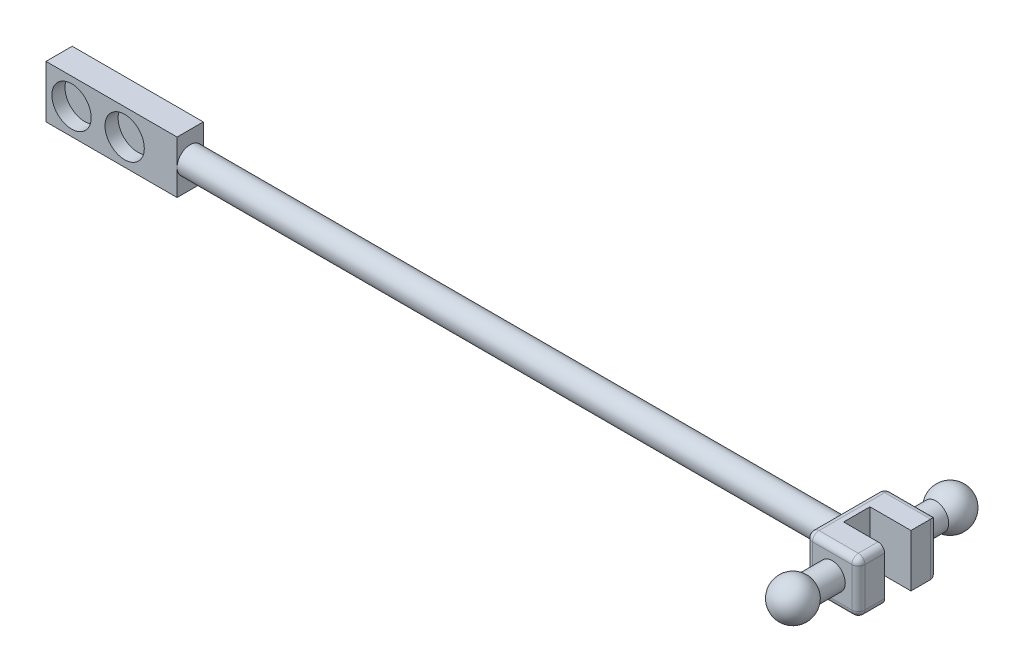
from build123d import *

# Parameters (mm, degrees)
SKETCH1_W           = 10
SKETCH1_H           = 4
BOSS_EXTRUDE1_DEPTH = 2
SKETCH2_R           = 1.5
CUT_EXTRUDE1_DEPTH  = 1
SKETCH3_R           = 1
BOSS_EXTRUDE2_DEPTH = 50
BOSS_EXTRUDE3_DEPTH = 4
FILLET1_R           = 0.5
SKETCH6_R           = 1
BOSS_EXTRUDE6_DEPTH = 3
FILLET2_R           = 0.5
SKETCH18_R          = 0.996476916
BOSS_EXTRUDE7_DEPTH = 3


with BuildPart() as part:
    # Sketch1 → Boss-Extrude1 (new body)
    with BuildSketch(Plane.XY):
        with Locations((-90.227807008, -9.049640054)):
            Rectangle(SKETCH1_W, SKETCH1_H)
    extrude(amount=BOSS_EXTRUDE1_DEPTH)

    # Sketch2 → Cut-Extrude1 (cut)
    with BuildSketch(Plane.XY.offset(2)):
        with Locations((-93.279774428, -9.049640054)):
            Circle(SKETCH2_R)
        with Locations((-89.227807008, -9.049640054)):
            Circle(SKETCH2_R)
    extrude(amount=-CUT_EXTRUDE1_DEPTH, mode=Mode.SUBTRACT)

    # Sketch3 → Boss-Extrude2 (add)
    with BuildSketch(Plane(origin=(-85.227807008, 0, 0), x_dir=(0, 0, -1), z_dir=(1, 0, 0))):
        with Locations((-1, -9.054602908)):
            Circle(SKETCH3_R)
    extrude(amount=BOSS_EXTRUDE2_DEPTH)

    # Sketch4 → Boss-Extrude3 (add)
    with BuildSketch(Plane(origin=(0, -7.049640054, 0), x_dir=(1, 0, 0), z_dir=(0, 1, 0))):
        Polygon((-35.238104557, 0), (-35.238104557, 2), (-31.238104557, 2), (-31.238104557, 0), (-34.367083254, 0), (-34.367083254, -2.010361564), (-31.238104557, -2.010361564), (-31.238104557, -4.010361564), (-35.238104557, -4.010361564), align=None)
    extrude(amount=-BOSS_EXTRUDE3_DEPTH)

    # Fillet1
    fillet1_edges = [part.edges().sort_by_distance(p)[0] for p in [
        (-35.238104557, -11.049640054, 1.005180782),
        (-35.238104557, -9.049640054, 4.010361564),
        (-33.238104557, -11.049640054, -2),
        (-35.238104557, -9.049640054, -2),
        (-31.238104557, -9.049640054, -2),
        (-33.238104557, -11.049640054, 4.010361564),
        (-35.238104557, -7.049640054, 1.005180782),
        (-33.238104557, -7.049640054, 4.010361564),
        (-33.238104557, -7.049640054, -2),
    ]]
    fillet(fillet1_edges, radius=FILLET1_R)

    # Sketch6 → Boss-Extrude6 (add)
    with BuildSketch(Plane(origin=(0, 0, -2), x_dir=(-1, 0, 0), z_dir=(0, 0, -1))):
        with Locations((33.238104557, -9.038134052)):
            Circle(SKETCH6_R)
    extrude(amount=BOSS_EXTRUDE6_DEPTH)

    # Sketch16 → Revolve10 (revolve)
    with BuildSketch(Plane(origin=(0, 0, -5), x_dir=(-1, 0, 0), z_dir=(0, 0, -1))):
        with BuildLine():
            Line((33.238104557, -7.549640054), (33.238104557, -10.549640054))
            ThreePointArc((33.238104557, -10.549640054), (34.738104557, -9.049640054), (33.238104557, -7.549640054))
        make_face()
    revolve(axis=Axis((-33.238104557, -1009.038134052, -5), (0, 1, 0)))

    # Fillet2
    fillet2_edges = [part.edges().sort_by_distance(p)[0] for p in [
        (-31.238104557, -11.049640054, 2.760361564),
        (-31.238104557, -7.049640054, 2.760361564),
        (-31.238104557, -9.049640054, 4.010361564),
        (-31.238104557, -7.196086663, 3.863914954),
        (-31.238104557, -10.903193444, 3.863914954),
    ]]
    fillet(fillet2_edges, radius=FILLET2_R)

    # Sketch18 → Boss-Extrude7 (add)
    with BuildSketch(Plane.XY.offset(4.010361564)):
        with Locations((-33.23429851, -9.03071029)):
            Circle(SKETCH18_R)
    extrude(amount=BOSS_EXTRUDE7_DEPTH)

    # Sketch20 → Revolve22 (revolve)
    with BuildSketch(Plane.XY.offset(7.010361564)):
        with BuildLine():
            Line((-33.23429851, -7.550711674), (-33.23429851, -10.510708905))
            ThreePointArc((-33.23429851, -10.510708905), (-31.754299895, -9.03071029), (-33.23429851, -7.550711674))
        make_face()
    revolve(axis=Axis((-33.23429851, -1009.03071029, 7.010361564), (0, 1, 0)))


solid = part.part
